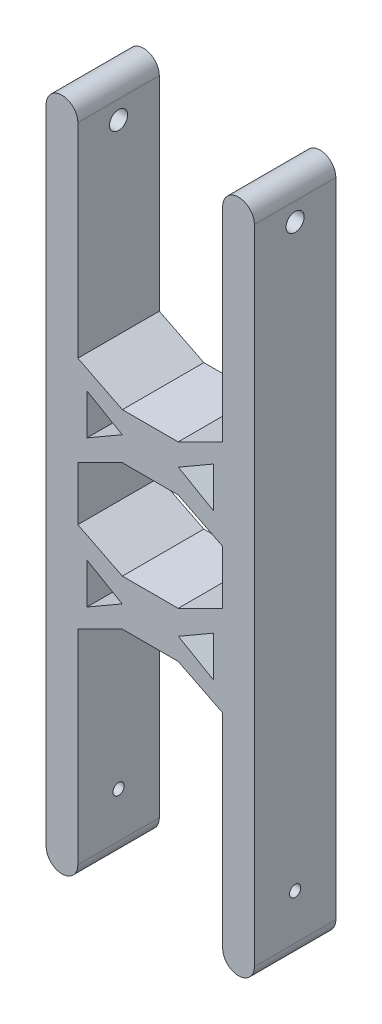
from build123d import *

# Parameters (mm, degrees)
BOSS_EXTRUDE1_DEPTH = 22.86
SKETCH3_R           = 1.5875
CUT_EXTRUDE1_DEPTH  = 136.30034598
SKETCH4_R           = 2.54
CUT_EXTRUDE2_DEPTH  = 136.30034598


with BuildPart() as part:
    # Sketch2 → Boss-Extrude1 (new body)
    with BuildSketch(Plane.XY):
        with BuildLine():
            Line((-20.32, 64.907113706), (-20.32, 7.660427971))
            Line((-20.32, 7.660427971), (-7.827723958, 1.407113706))
            Line((-7.827723958, 1.407113706), (7.827723958, 1.407113706))
            Line((7.827723958, 1.407113706), (20.32, 7.660427971))
            Line((20.32, 7.660427971), (20.32, 64.907113706))
            ThreePointArc((20.32, 64.907113706), (24.765, 69.352113706), (29.21, 64.907113706))
            Line((29.21, 64.907113706), (29.21, -115.432886294))
            ThreePointArc((29.21, -115.432886294), (24.765, -119.877886294), (20.32, -115.432886294))
            Line((20.32, -115.432886294), (20.32, -58.186200558))
            Line((20.32, -58.186200558), (7.827723958, -51.932886294))
            Line((7.827723958, -51.932886294), (-7.827723958, -51.932886294))
            Line((-7.827723958, -51.932886294), (-20.32, -58.186200558))
            Line((-20.32, -58.186200558), (-20.32, -115.432886294))
            ThreePointArc((-20.32, -115.432886294), (-24.765, -119.877886294), (-29.21, -115.432886294))
            Line((-29.21, -115.432886294), (-29.21, 64.907113706))
            ThreePointArc((-29.21, 64.907113706), (-24.765, 69.352113706), (-20.32, 64.907113706))
        make_face()
        Polygon((-17.78, -40.099060348), (-17.78, -51.529060348), (-7.881329635, -45.814060348), align=None, mode=Mode.SUBTRACT)
        Polygon((-20.32, -32.786200558), (-7.827723958, -39.039514822), (7.827723958, -39.039514822), (20.32, -32.786200558), (20.32, -17.739572029), (7.827723958, -11.486257765), (-7.827723958, -11.486257765), (-20.32, -17.739572029), align=None, mode=Mode.SUBTRACT)
        Polygon((-17.78, 1.003287761), (-7.881329635, -4.711712239), (-17.78, -10.426712239), align=None, mode=Mode.SUBTRACT)
        Polygon((17.78, -51.529060348), (7.881329635, -45.814060348), (17.78, -40.099060348), align=None, mode=Mode.SUBTRACT)
        Polygon((17.78, -10.426712239), (17.78, 1.003287761), (7.881329635, -4.711712239), align=None, mode=Mode.SUBTRACT)
    extrude(amount=BOSS_EXTRUDE1_DEPTH)

    # Sketch3 → Cut-Extrude1 (cut, through all)
    with BuildSketch(Plane.ZY.offset(29.21)):
        with Locations((11.43, -102.732886294)):
            Circle(SKETCH3_R)
    extrude(amount=-CUT_EXTRUDE1_DEPTH, mode=Mode.SUBTRACT)

    # Sketch4 → Cut-Extrude2 (cut, through all)
    with BuildSketch(Plane.ZY.offset(29.21)):
        with Locations((11.43, 59.827113706)):
            Circle(SKETCH4_R)
    extrude(amount=-CUT_EXTRUDE2_DEPTH, mode=Mode.SUBTRACT)


solid = part.part
